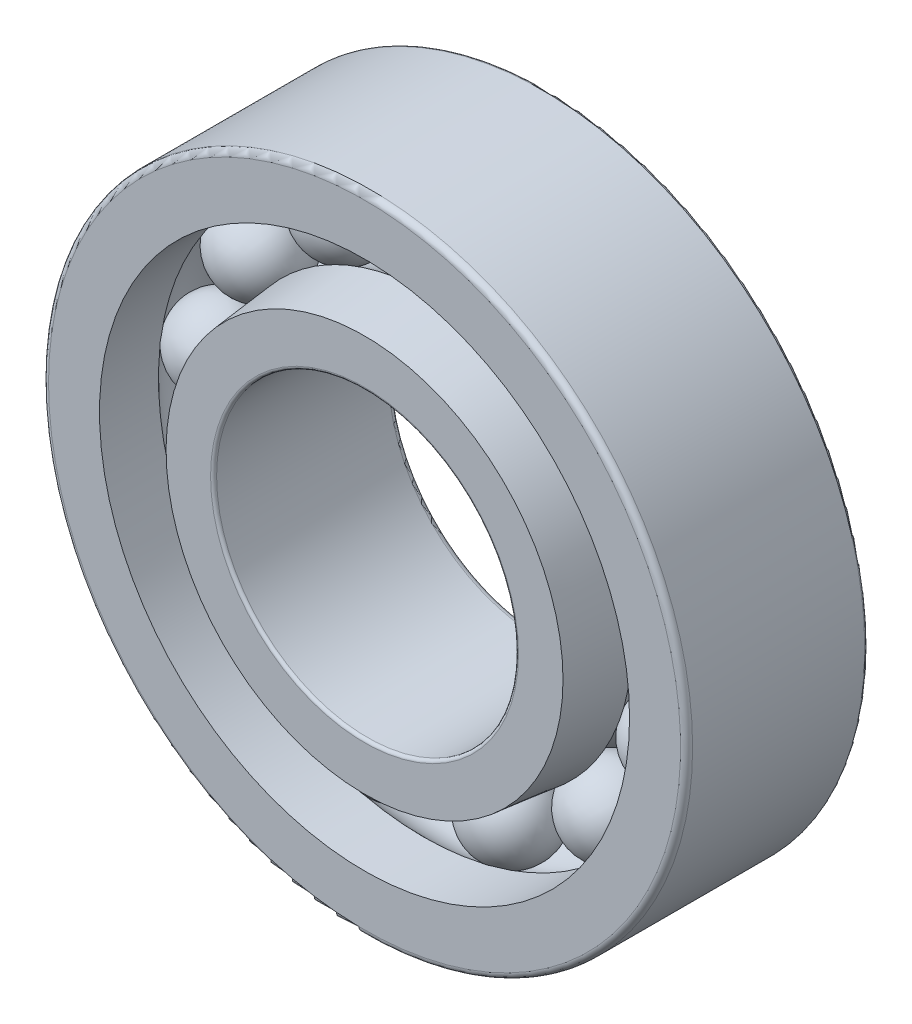
from build123d import *

# Parameters (mm, degrees)
FILLET1_R            = 0.3
FILLET2_R            = 0.15
CIRPATTERNBALL_COUNT = 13


with BuildPart() as part:
    # BaseSke → Ball (revolve)
    with BuildSketch(Plane(origin=(0, 0, 0), x_dir=(0, 0, -1), z_dir=(1, 0, 0))):
        with BuildLine():
            Line((0, 13.875), (0, 9.625))
            ThreePointArc((0, 9.625), (-2.125, 11.75), (0, 13.875))
        make_face()
    ball = revolve(axis=Axis((0, 13.875, 0), (0, -1, 0)))

    # OuterRaceSke → OuterRace (revolve)
    with BuildSketch(Plane(origin=(0, 0, 0), x_dir=(0, 0, -1), z_dir=(1, 0, 0)), mode=Mode.PRIVATE) as outerrace_sk:
        with BuildLine():
            Line((-4.5, 16), (4.5, 16))
            Line((4.5, 16), (4.5, 13.639635725))
            Line((4.5, 13.639635725), (1.421493754, 13.316071681))
            ThreePointArc((1.421493754, 13.316071681), (-0.105483085, 13.862367941), (-1.570439606, 13.166666667))
            Line((-1.570439606, 13.166666667), (-4.5, 13.166666667))
            Line((-4.5, 13.166666667), (-4.5, 16))
        make_face()
    revolve(outerrace_sk.sketch.rotate(Axis((0, 0, 50.391616343), (0, 0, -1)), 90), axis=Axis((0, 0, 50.391616343), (0, 0, -1)))

    # InnerRaceSke → InnerRace (revolve)
    with BuildSketch(Plane(origin=(0, 0, 0), x_dir=(0, 0, -1), z_dir=(1, 0, 0)), mode=Mode.PRIVATE) as innerrace_sk:
        with BuildLine():
            Line((-4.5, 7.5), (4.5, 7.5))
            Line((4.5, 7.5), (4.5, 10.333333333))
            Line((4.5, 10.333333333), (1.570439606, 10.333333333))
            ThreePointArc((1.570439606, 10.333333333), (0, 9.635), (-1.570439606, 10.333333333))
            Line((-1.570439606, 10.333333333), (-4.5, 10.333333333))
            Line((-4.5, 10.333333333), (-4.5, 7.5))
        make_face()
    revolve(innerrace_sk.sketch.rotate(Axis((0, 0, 70.862590906), (0, 0, -1)), 90), axis=Axis((0, 0, 70.862590906), (0, 0, -1)))

    # Fillet1
    fillet1_edges = [part.edges().sort_by_distance(p)[0] for p in [
        (-7.5, 0, -4.5),
        (-16, 0, 4.5),
    ]]
    fillet(fillet1_edges, radius=FILLET1_R)

    # Fillet2
    fillet2_edges = [part.edges().sort_by_distance(p)[0] for p in [
        (-7.5, 0, 4.5),
        (-16, 0, -4.5),
    ]]
    fillet(fillet2_edges, radius=FILLET2_R)

    # CutInnerRaceSke → CutInnerRace (revolve, cut)
    with BuildSketch(Plane(origin=(0, 0, 0), x_dir=(0, 0, -1), z_dir=(1, 0, 0)), mode=Mode.PRIVATE) as cutinnerrace_sk:
        with BuildLine():
            Line((-1.570439606, 10.333333333), (-4.5, 10.333333333))
            Line((-4.5, 10.333333333), (-4.5, 9.860364275))
            Line((-4.5, 9.860364275), (-1.421493754, 10.183928319))
            ThreePointArc((-1.421493754, 10.183928319), (-1.497830688, 10.256772546), (-1.570439606, 10.333333333))
        make_face()
    revolve(cutinnerrace_sk.sketch.rotate(Axis((0, 0, 28.306583022), (0, 0, -1)), 270), axis=Axis((0, 0, 28.306583022), (0, 0, -1)), mode=Mode.SUBTRACT)

    # CirPatternBall: Ball ×13 about axis
    cirpatternball_axis = Axis((0, 0, 0), (0, 0, 1))
    for i in range(1, CIRPATTERNBALL_COUNT):
        add(ball.rotate(cirpatternball_axis, i * 360 / CIRPATTERNBALL_COUNT))


solid = part.part
